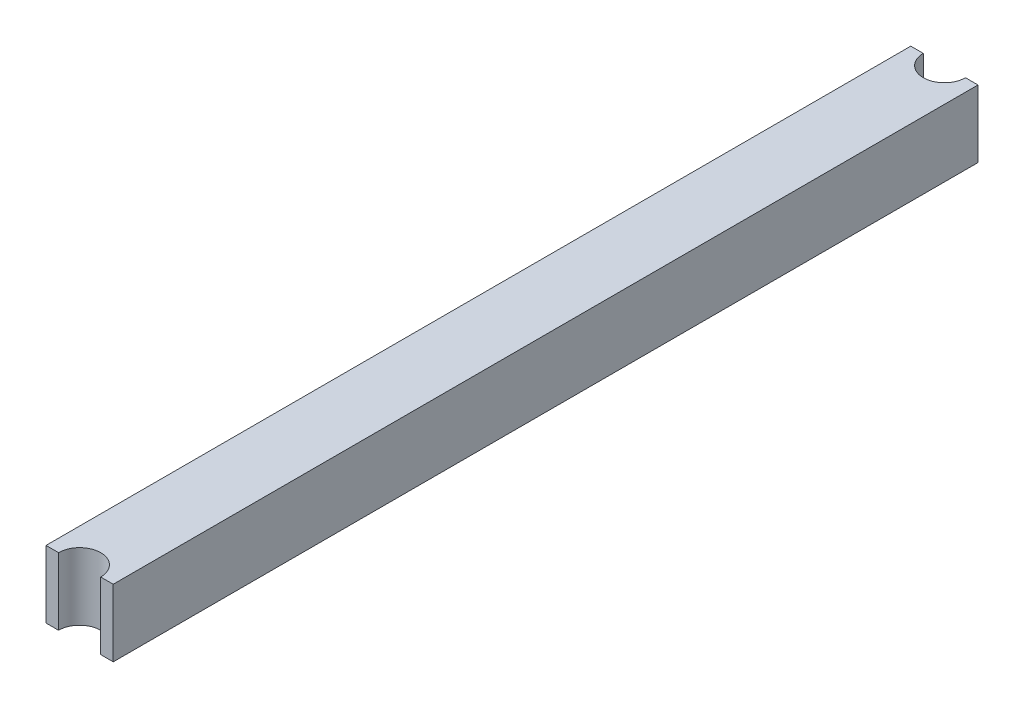
from build123d import *

# Parameters (mm, degrees)
SKETCH1_W           = 31.1
SKETCH1_H           = 31.1
BOSS_EXTRUDE1_DEPTH = 400
SKETCH2_R           = 9.755
CUT_EXTRUDE1_DEPTH  = 31.1


with BuildPart() as part:
    # Sketch1 → Boss-Extrude1 (new body)
    with BuildSketch(Plane.XY):
        with Locations((-15.55, 15.55)):
            Rectangle(SKETCH1_W, SKETCH1_H)
    extrude(amount=BOSS_EXTRUDE1_DEPTH)

    # Sketch2 → Cut-Extrude1 (cut)
    with BuildSketch(Plane(origin=(0, 31.1, 0), x_dir=(1, 0, 0), z_dir=(0, 1, 0))):
        with Locations((-15.55, -400)):
            Circle(SKETCH2_R)
        with Locations((-15.55, 0)):
            Circle(SKETCH2_R)
    extrude(amount=-CUT_EXTRUDE1_DEPTH, mode=Mode.SUBTRACT)


solid = part.part
